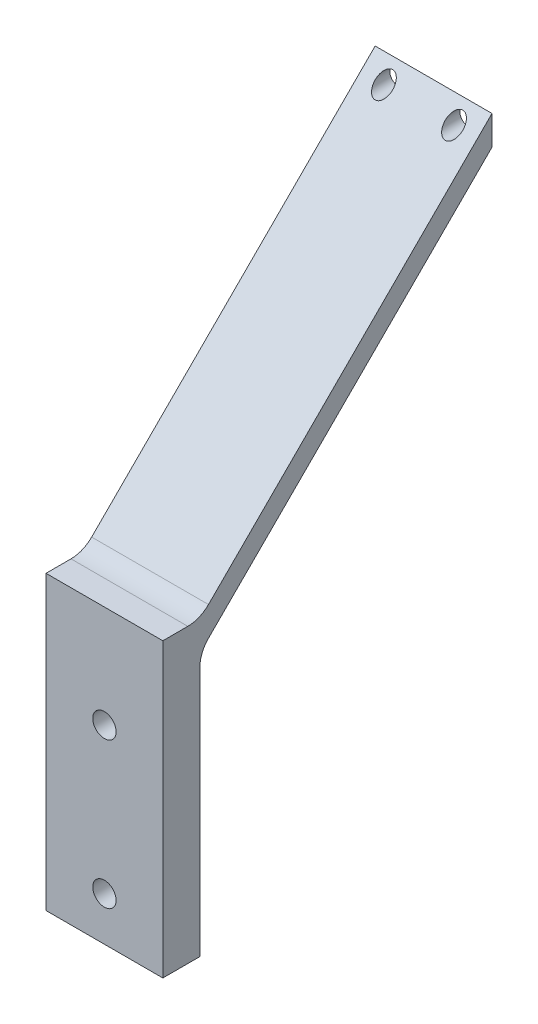
from build123d import *

# Parameters (mm, degrees)
SKETCH1_W           = 20
SKETCH1_H           = 40
SKETCH1_R           = 2
BOSS_EXTRUDE1_DEPTH = 6.35
SKETCH2_W           = 20
SKETCH2_H           = 6.35
BOSS_EXTRUDE2_DEPTH = 10
BOSS_EXTRUDE3_DEPTH = 20
SKETCH4_R           = 1.5
CUT_EXTRUDE1_DEPTH  = 23.2
FILLET1_R           = 5


with BuildPart() as part:
    # Sketch1 → Boss-Extrude1 (new body)
    with BuildSketch(Plane.XY):
        with Locations((10, 20)):
            Rectangle(SKETCH1_W, SKETCH1_H)
        with Locations((10, 32.5)):
            Circle(SKETCH1_R, mode=Mode.SUBTRACT)
        with Locations((10, 7.5)):
            Circle(SKETCH1_R, mode=Mode.SUBTRACT)
    extrude(amount=BOSS_EXTRUDE1_DEPTH)

    # Sketch2 → Boss-Extrude2 (add)
    with BuildSketch(Plane(origin=(0, 40, 0), x_dir=(1, 0, 0), z_dir=(0, 1, 0))):
        with Locations((10, -3.175)):
            Rectangle(SKETCH2_W, SKETCH2_H)
    extrude(amount=BOSS_EXTRUDE2_DEPTH)

    # Sketch3 → Boss-Extrude3 (add)
    with BuildSketch(Plane(origin=(20, 0, 0), x_dir=(0, 0, -1), z_dir=(1, 0, 0))):
        Polygon((50, 100), (50, 95), (0, 45), (0, 50), align=None)
    extrude(amount=-BOSS_EXTRUDE3_DEPTH)

    # Sketch4 → Cut-Extrude1 (cut)
    with BuildSketch(Plane(origin=(0, 0, -50), x_dir=(-1, 0, 0), z_dir=(0, 0, -1))):
        with Locations((-16, 97.5)):
            Circle(SKETCH4_R)
        with Locations((-4, 97.5)):
            Circle(SKETCH4_R)
    extrude(amount=-CUT_EXTRUDE1_DEPTH, mode=Mode.SUBTRACT)

    # Fillet1
    fillet1_edges = [part.edges().sort_by_distance(p)[0] for p in [
        (10, 50, 0),
        (10, 45, 0),
    ]]
    fillet(fillet1_edges, radius=FILLET1_R)


solid = part.part
